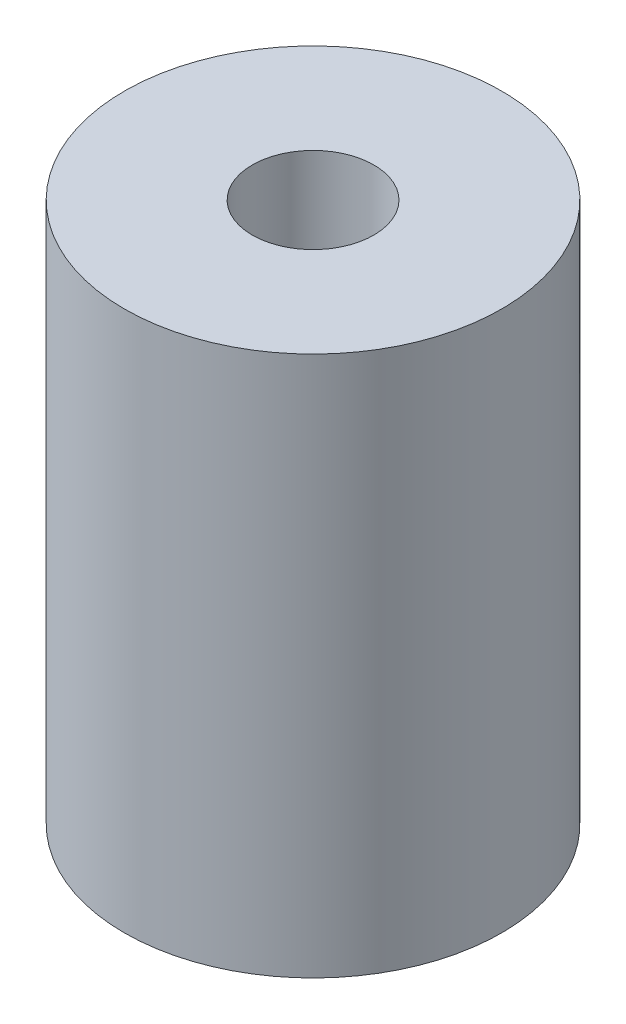
from build123d import *

# Parameters (mm, degrees)
SKETCH2_R           = 6.985
SKETCH2_R_2         = 2.25
BOSS_EXTRUDE3_DEPTH = 20


with BuildPart() as part:
    # Sketch2 → Boss-Extrude3 (new body)
    with BuildSketch(Plane(origin=(0, 0, 0), x_dir=(1, 0, 0), z_dir=(0, 1, 0))):
        with Locations(Location((0, 0, 0), (0, 0, 270))):
            Circle(SKETCH2_R)
        with Locations(Location((0, 0, 0), (0, 0, 270))):
            Circle(SKETCH2_R_2, mode=Mode.SUBTRACT)
    extrude(amount=BOSS_EXTRUDE3_DEPTH)


solid = part.part
